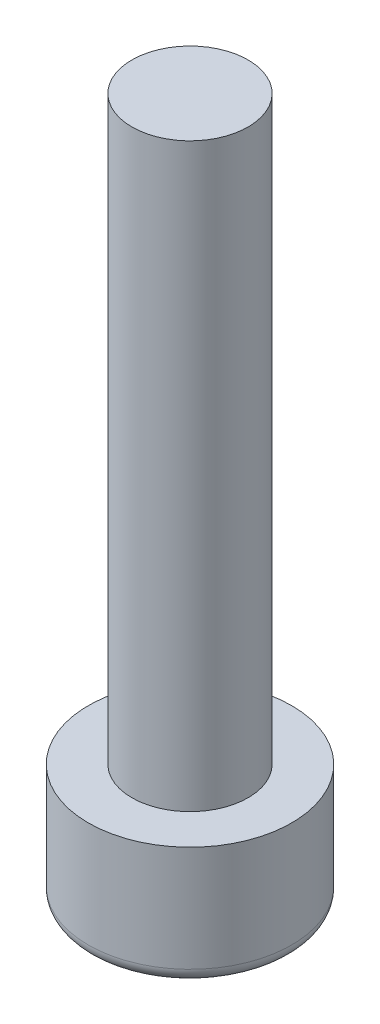
from build123d import *

# Parameters (mm, degrees)
SKETCH_1_R          = 3.5
EXTRUDE_1_DEPTH     = 4.14
SKETCH_2_R          = 2
EXTRUDE_2_DEPTH     = 20
FILLET_1_R          = 0.5
CUT_EXTRUDE_1_DEPTH = 2


with BuildPart() as part:
    # 草图1 → 凸台-拉伸1 (new body)
    with BuildSketch(Plane(origin=(0, 0, 0), x_dir=(1, 0, 0), z_dir=(0, 1, 0))):
        with Locations(Location((0, 0, 0), (0, 0, 270))):
            Circle(SKETCH_1_R)
    extrude(amount=EXTRUDE_1_DEPTH)

    # 草图2 → 凸台-拉伸2 (add)
    with BuildSketch(Plane(origin=(0, 4.14, 0), x_dir=(1, 0, 0), z_dir=(0, 1, 0))):
        with Locations(Location((0, 0, 0), (0, 0, 270))):
            Circle(SKETCH_2_R)
    extrude(amount=EXTRUDE_2_DEPTH)

    # 圆角1
    fillet_1_edges = [part.edges().sort_by_distance(p)[0] for p in [
        (0, 0, -3.5),
    ]]
    fillet(fillet_1_edges, radius=FILLET_1_R)

    # 草图3 → 切除-拉伸1 (cut)
    with BuildSketch(Plane.XZ):
        Polygon((1.698287208, 2.056072434), (-0.931467356, 2.498796082), (-2.629754564, 0.442723648), (-1.698287208, -2.056072434), (0.931467356, -2.498796082), (2.629754564, -0.442723648), align=None)
    extrude(amount=-CUT_EXTRUDE_1_DEPTH, mode=Mode.SUBTRACT)


solid = part.part
